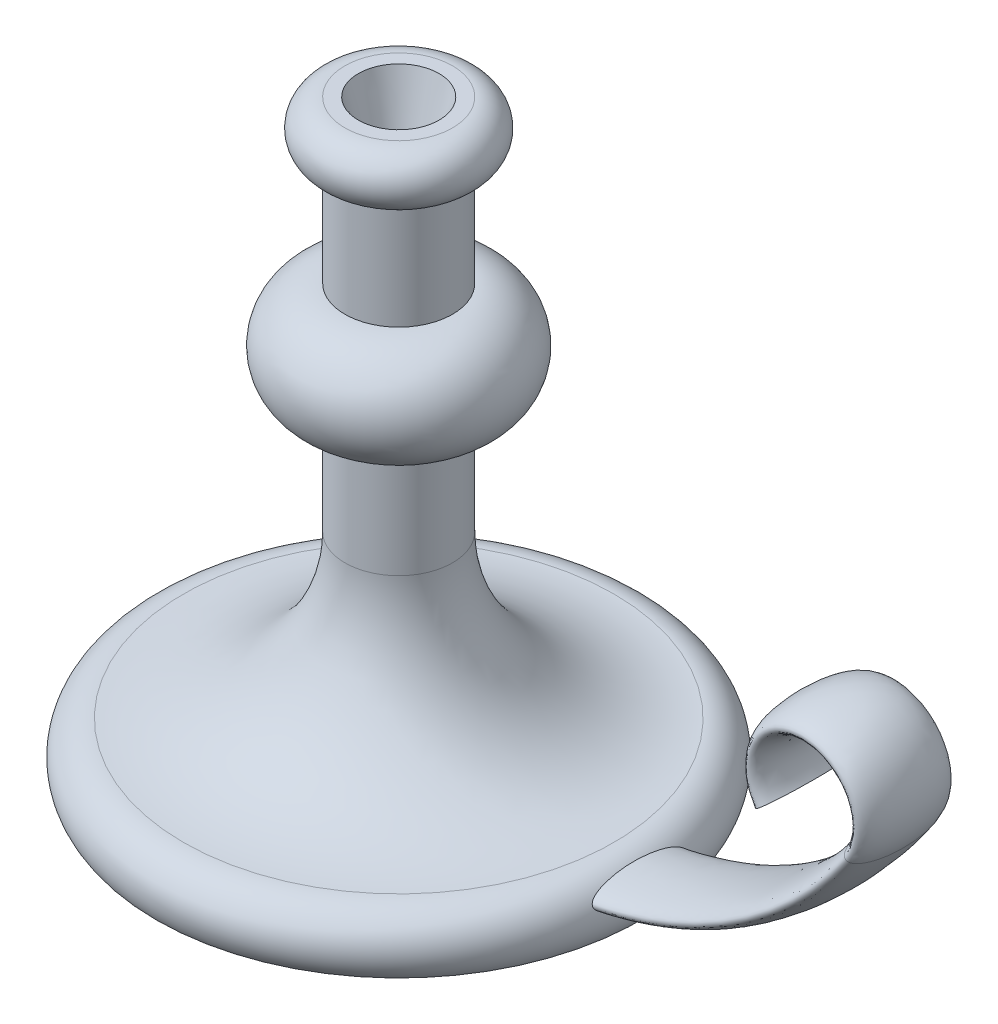
from build123d import *

# Parameters (mm, degrees)
SKETCH3_RX         = 17.5
SKETCH3_RY         = 5
SKETCH4_R          = 15
CUT_EXTRUDE1_DEPTH = 25
CUT_EXTRUDE1_DRAFT = -15


with BuildPart() as part:
    # Sketch1 → Revolve1 (revolve)
    with BuildSketch(Plane.XY, mode=Mode.PRIVATE) as revolve1_sk:
        with BuildLine():
            Line((0, 0), (0, 220))
            Line((0, 220), (20, 220))
            ThreePointArc((20, 220), (30, 210), (20, 200))
            Line((20, 200), (20, 160))
            ThreePointArc((20, 160), (40, 140), (20, 120))
            Line((20, 120), (20, 80))
            ThreePointArc((20, 80), (37.573593129, 37.573593129), (80, 20))
            ThreePointArc((80, 20), (91.180339887, 13.090169944), (90, 0))
            Line((90, 0), (0, 0))
        make_face()
    revolve(revolve1_sk.sketch.rotate(Axis((0, 0, 0), (0, 1, 0)), 90), axis=Axis((0, 0, 0), (0, 1, 0)))

    # Sweep1: sweep along a path in Sketch2
    with BuildLine(Plane.XY) as sweep1_path:
        Line((0, 10), (60, 10))
        ThreePointArc((60, 10), (129.821200219, 27.240819526), (183.592070943, 75))
        ThreePointArc((183.592070943, 75), (167.113128151, 106.333333333), (150.634185358, 75))
    # Sketch3 → Sweep1 (sweep)
    with BuildSketch(Plane(origin=(0, 0, 0), x_dir=(0, 0, -1), z_dir=(1, 0, 0))):
        with Locations(Location((0, 10), (0, 0, 180))):
            Ellipse(SKETCH3_RX, SKETCH3_RY)
    sweep(path=sweep1_path.line)


with BuildPart() as cut_extrude1_tool:
    # Sketch4 → Cut-Extrude1 (with draft: the straight prism first)
    with BuildSketch(Plane(origin=(0, 220, 0), x_dir=(1, 0, 0), z_dir=(0, 1, 0))):
        Circle(SKETCH4_R)
    extrude(amount=-CUT_EXTRUDE1_DEPTH)
    # Cut-Extrude1: the draft: its side faces are tilted about the plane it starts from
    cut_extrude1_sides = [cut_extrude1_tool.faces().sort_by_distance(p)[0] for p in [
        (-15, 207.5, 0),
    ]]
    draft(cut_extrude1_sides, Plane(origin=(0, 220, 0), x_dir=(1, 0, 0), z_dir=(0, 1, 0)), CUT_EXTRUDE1_DRAFT)


with BuildPart() as part_1:
    add(part.part)

    # Cut-Extrude1: cut by cut_extrude1_tool
    add(cut_extrude1_tool.part, mode=Mode.SUBTRACT)


solid = part_1.part
